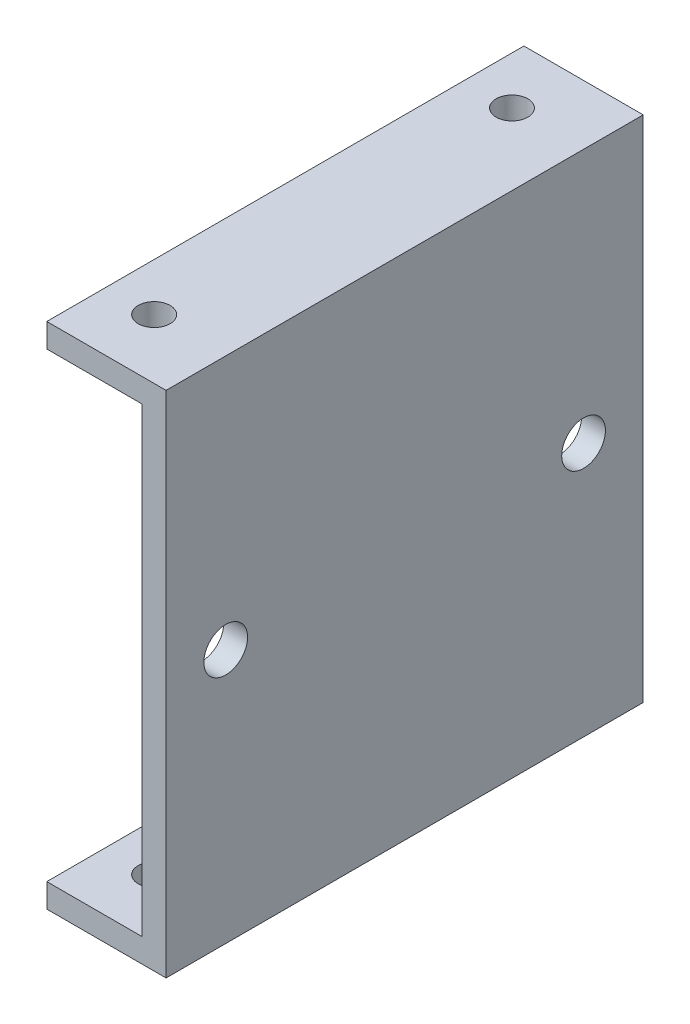
from build123d import *

# Parameters (mm, degrees)
EXTRUDE_1_DEPTH          = 30
CUT_EXTRUDE_1_DEPTH      = 73.256487598
CUT_EXTRUDE_1_DEPTH_BACK = 73.256487598
SKETCH_2_R               = 2
SKETCH_3_R               = 2.75
CUT_EXTRUDE_2_DEPTH      = 73.256487598


with BuildPart() as part:
    # 草图1 → 凸台-拉伸1 (new, symmetric)
    with BuildSketch(Plane.XY):
        Polygon((0, 0), (15, 0), (15, -64), (0, -64), (0, -61), (12, -61), (12, -3), (0, -3), align=None)
    extrude(amount=EXTRUDE_1_DEPTH, both=True)

    # 草图2 → 切除-拉伸1 (cut, two sides: drawn at the far end of the back side and taken through both)
    with BuildSketch(Plane(origin=(0, 0, 0), x_dir=(1, 0, 0), z_dir=(0, 1, 0)).offset(-CUT_EXTRUDE_1_DEPTH_BACK)):
        with Locations(Location((6, 22.5, 0), (0, 0, 270))):
            Circle(SKETCH_2_R)
        with Locations(Location((6, -22.5, 0), (0, 0, 270))):
            Circle(SKETCH_2_R)
    extrude(amount=CUT_EXTRUDE_1_DEPTH + CUT_EXTRUDE_1_DEPTH_BACK, mode=Mode.SUBTRACT)

    # 草图3 → 切除-拉伸2 (cut, through all)
    with BuildSketch(Plane(origin=(15, 0, 0), x_dir=(0, 0, -1), z_dir=(1, 0, 0))):
        with Locations(Location((-22.5, -32, 0), (0, 0, 90))):
            Circle(SKETCH_3_R)
        with Locations(Location((22.5, -32, 0), (0, 0, 90))):
            Circle(SKETCH_3_R)
    extrude(amount=-CUT_EXTRUDE_2_DEPTH, mode=Mode.SUBTRACT)


solid = part.part
